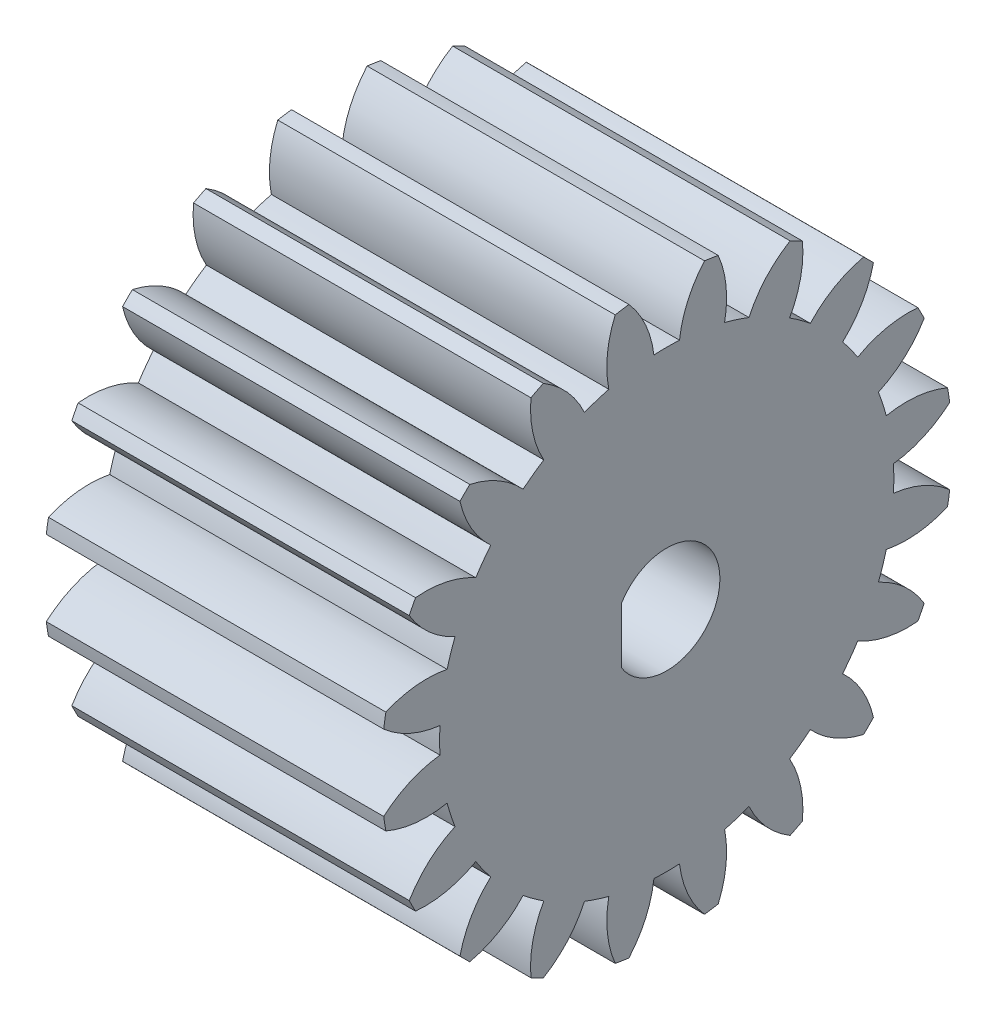
from build123d import *

# Parameters (mm, degrees)
BASPROSKE_W     = 26
BASPROSKE_H     = 22
TOOTHCUT_DEPTH  = 41.546269865
TEETHCUTS_COUNT = 20
TEETHCUTS_ANGLE = 342
BORE_DEPTH      = 50.0000508


with BuildPart() as part:
    # BasProSke → Base-Revolve (revolve)
    with BuildSketch(Plane(origin=(0, 0, 0), x_dir=(1, 0, 0), z_dir=(0, 1, 0)), mode=Mode.PRIVATE) as base_revolve_sk:
        with Locations((13, 11)):
            Rectangle(BASPROSKE_W, BASPROSKE_H)
    revolve(base_revolve_sk.sketch.rotate(Axis((-10, 0, 0), (1, 0, 0)), 180), axis=Axis((-10, 0, 0), (1, 0, 0)))

    # TooCutSke → ToothCut (cut, through all)
    with BuildSketch(Plane(origin=(0, 0, 0), x_dir=(0, 0, -1), z_dir=(1, 0, 0))):
        with BuildLine():
            ThreePointArc((0.986171591, 17.471189616), (0, 17.499), (-0.986171591, 17.471189616))
            ThreePointArc((-0.986171591, 17.471189616), (-1.626916196, 19.798789858), (-2.932850173, 21.829260982))
            ThreePointArc((-2.932850173, 21.829260982), (0, 22.0254), (2.932850173, 21.829260982))
            ThreePointArc((2.932850173, 21.829260982), (1.626916196, 19.798789858), (0.986171591, 17.471189616))
        make_face()
    toothcut = extrude(amount=TOOTHCUT_DEPTH, mode=Mode.SUBTRACT)

    # TeethCuts: ToothCut ×20 about axis
    teethcuts_axis = Axis((-10, 0, 0), (1, 0, 0))
    for i in range(1, TEETHCUTS_COUNT):
        add(toothcut.rotate(teethcuts_axis, i * TEETHCUTS_ANGLE / (TEETHCUTS_COUNT - 1)), mode=Mode.SUBTRACT)

    # BorSke → Bore (cut, symmetric)
    with BuildSketch(Plane(origin=(0, 0, 0), x_dir=(0, 0, -1), z_dir=(1, 0, 0))):
        with BuildLine():
            Line((-3.5, -2.13541565), (-3.5, 2.13541565))
            ThreePointArc((-3.5, 2.13541565), (4.1, 0), (-3.5, -2.13541565))
        make_face()
    extrude(amount=BORE_DEPTH, both=True, mode=Mode.SUBTRACT)


solid = part.part
